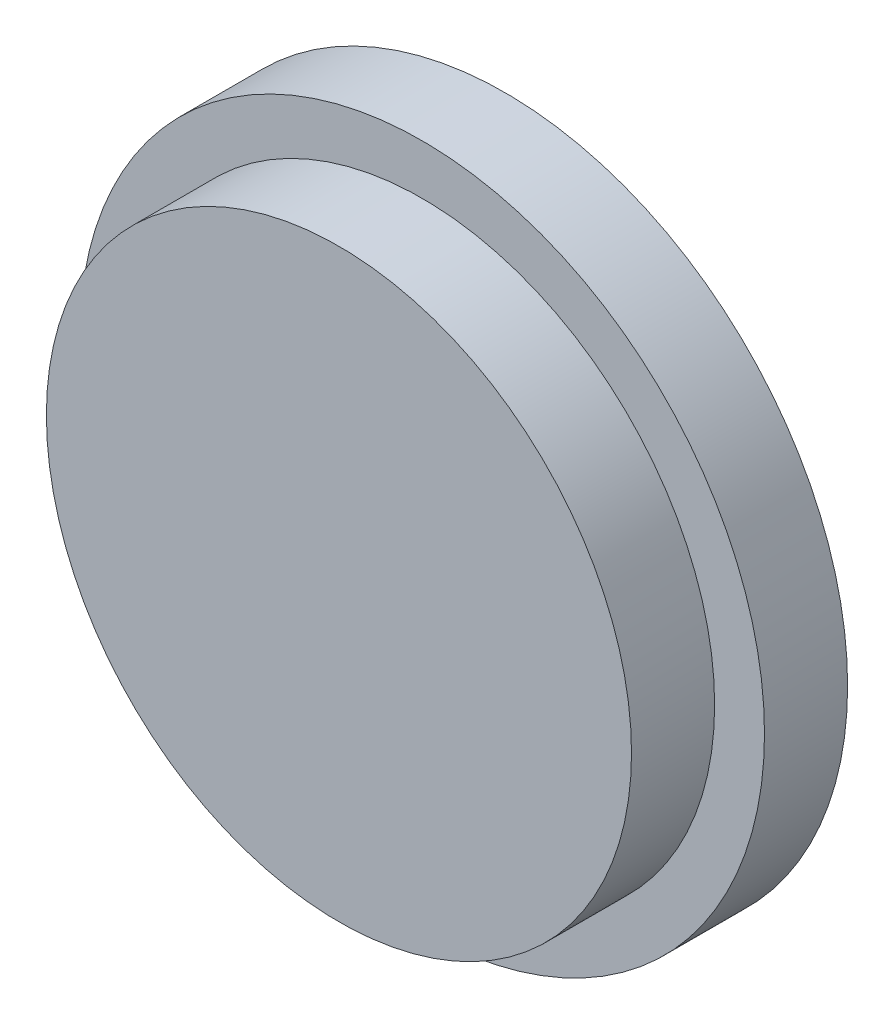
from build123d import *

# Parameters (mm, degrees)
SKETCH_1_R          = 41.2
EXTRUDE_1_DEPTH     = 20
SKETCH_2_OUTSIDE_W  = 108.048
SKETCH_2_OUTSIDE_H  = 108.048
SKETCH_2_OUTSIDE_R  = 35.2
CUT_EXTRUDE_1_DEPTH = 10


with BuildPart() as part:
    # 草图1 → 凸台-拉伸1 (new body)
    with BuildSketch(Plane.XY):
        Circle(SKETCH_1_R)
    extrude(amount=EXTRUDE_1_DEPTH)

    # 草图2 outside → 切除-拉伸1 (cut)
    with BuildSketch(Plane.XY.offset(20)):
        Rectangle(SKETCH_2_OUTSIDE_W, SKETCH_2_OUTSIDE_H)
        Circle(SKETCH_2_OUTSIDE_R, mode=Mode.SUBTRACT)
    extrude(amount=-CUT_EXTRUDE_1_DEPTH, mode=Mode.SUBTRACT)


solid = part.part
